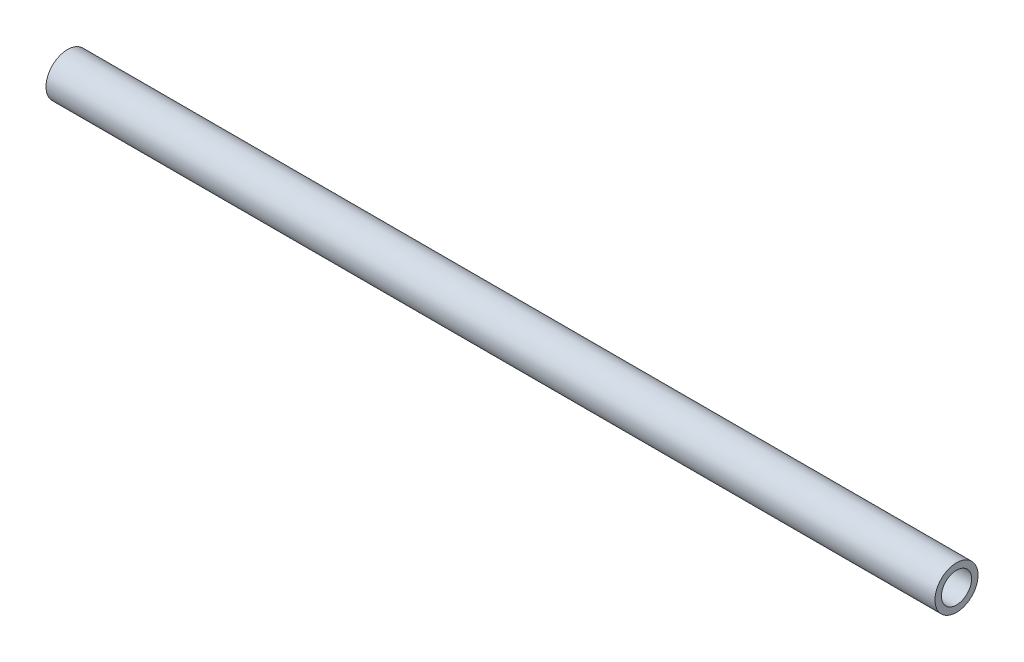
from build123d import *

# Parameters (mm, degrees)
ESBO_O1_W = 90.8
ESBO_O1_H = 0.66


with BuildPart() as part:
    # Esboço1 → Revolução1 (revolve)
    with BuildSketch(Plane.XY, mode=Mode.PRIVATE) as revolu_o1_sk:
        with Locations((45.4, 1.87)):
            Rectangle(ESBO_O1_W, ESBO_O1_H)
    revolve(revolu_o1_sk.sketch.rotate(Axis((0, 0, 0), (1, 0, 0)), 90), axis=Axis((0, 0, 0), (1, 0, 0)))


solid = part.part
